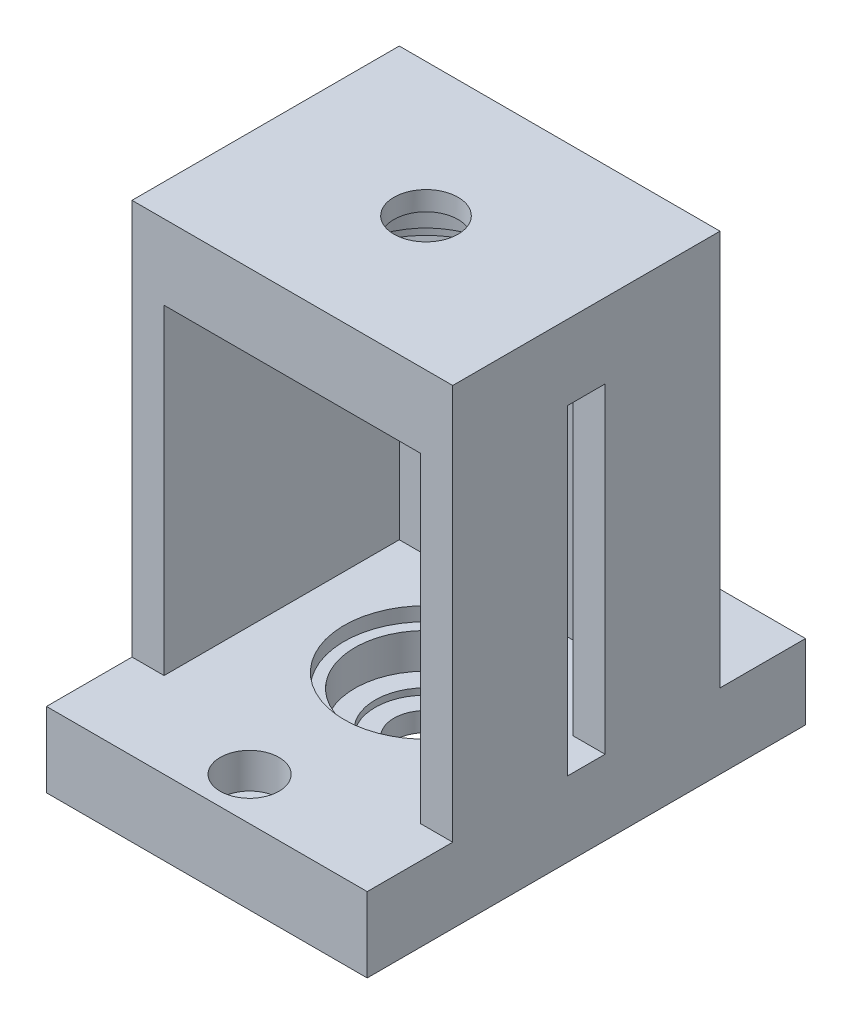
from build123d import *

# Parameters (mm, degrees)
SKETCH1_W               = 30
SKETCH1_H               = 25
BOSS_EXTRUDE1_DEPTH     = 7
BOSS_EXTRUDE2_DEPTH     = 30
SKETCH3_W               = 30
SKETCH3_H               = 25
BOSS_EXTRUDE3_DEPTH     = 7
SKETCH4_R               = 7.65
CUT_EXTRUDE1_DEPTH      = 1.3
CUT_EXTRUDE2_START      = -1.3
SKETCH5_R               = 7.65
CUT_EXTRUDE2_DEPTH      = 1.3
SKETCH6_R               = 6.65
CUT_EXTRUDE3_DEPTH      = 3.3
CUT_EXTRUDE4_START      = -3.3
SKETCH7_R               = 6.65
CUT_EXTRUDE4_DEPTH      = 3.3
SKETCH8_R               = 4.75
CUT_EXTRUDE5_DEPTH      = 0.6
CUT_EXTRUDE6_START      = -0.6
SKETCH9_R               = 4.75
CUT_EXTRUDE6_DEPTH      = 0.6
CUT_EXTRUDE7_DEPTH      = 47.498279538
CUT_EXTRUDE7_DEPTH_BACK = 47.498279538
SKETCH10_R              = 3
CUT_EXTRUDE8_DEPTH      = 55.701462503
CUT_EXTRUDE8_DEPTH_BACK = 10.6
SKETCH11_W              = 3.5
SKETCH11_H              = 30
SKETCH12_W              = 30
SKETCH12_H              = 8
SKETCH12_R              = 1.65
BOSS_EXTRUDE4_DEPTH     = 7
SKETCH13_R              = 2.75
CUT_EXTRUDE9_DEPTH      = 3.3


with BuildPart() as part:
    # Sketch1 → Boss-Extrude1 (new body)
    with BuildSketch(Plane(origin=(0, 0, 0), x_dir=(1, 0, 0), z_dir=(0, 1, 0))):
        Rectangle(SKETCH1_W, SKETCH1_H)
    extrude(amount=BOSS_EXTRUDE1_DEPTH)

    # Sketch2 → Boss-Extrude2 (add)
    with BuildSketch(Plane(origin=(0, 7, 0), x_dir=(1, 0, 0), z_dir=(0, 1, 0))):
        Polygon((-15, -12.5), (-12, -12.5), (-12, 9.5), (12, 9.5), (12, -12.5), (15, -12.5), (15, 12.5), (-15, 12.5), align=None)
    extrude(amount=BOSS_EXTRUDE2_DEPTH)

    # Sketch3 → Boss-Extrude3 (add)
    with BuildSketch(Plane(origin=(0, 37, 0), x_dir=(1, 0, 0), z_dir=(0, 1, 0))):
        Rectangle(SKETCH3_W, SKETCH3_H)
    extrude(amount=BOSS_EXTRUDE3_DEPTH)

    # Sketch4 → Cut-Extrude1 (cut)
    with BuildSketch(Plane(origin=(0, 7, 0), x_dir=(1, 0, 0), z_dir=(0, 1, 0))):
        with Locations(Location((0, 0, 0), (0, 0, 270))):
            Circle(SKETCH4_R)
    extrude(amount=-CUT_EXTRUDE1_DEPTH, mode=Mode.SUBTRACT)

    # Sketch5 → Cut-Extrude2 (cut)
    with BuildSketch(Plane.XZ.offset(-37).offset(CUT_EXTRUDE2_START)):
        with Locations(Location((0, 0, 0), (0, 0, 90))):
            Circle(SKETCH5_R)
    extrude(amount=CUT_EXTRUDE2_DEPTH, mode=Mode.SUBTRACT)

    # Sketch6 → Cut-Extrude3 (cut)
    with BuildSketch(Plane(origin=(0, 5.7, 0), x_dir=(1, 0, 0), z_dir=(0, 1, 0))):
        with Locations(Location((0, 0, 0), (0, 0, 270))):
            Circle(SKETCH6_R)
    extrude(amount=-CUT_EXTRUDE3_DEPTH, mode=Mode.SUBTRACT)

    # Sketch7 → Cut-Extrude4 (cut)
    with BuildSketch(Plane.XZ.offset(-38.3).offset(CUT_EXTRUDE4_START)):
        with Locations(Location((0, 0, 0), (0, 0, 90))):
            Circle(SKETCH7_R)
    extrude(amount=CUT_EXTRUDE4_DEPTH, mode=Mode.SUBTRACT)

    # Sketch8 → Cut-Extrude5 (cut)
    with BuildSketch(Plane(origin=(0, 2.4, 0), x_dir=(1, 0, 0), z_dir=(0, 1, 0))):
        with Locations(Location((0, 0, 0), (0, 0, 270))):
            Circle(SKETCH8_R)
    extrude(amount=-CUT_EXTRUDE5_DEPTH, mode=Mode.SUBTRACT)

    # Sketch9 → Cut-Extrude6 (cut)
    with BuildSketch(Plane.XZ.offset(-41.6).offset(CUT_EXTRUDE6_START)):
        with Locations(Location((0, 0, 0), (0, 0, 90))):
            Circle(SKETCH9_R)
    extrude(amount=CUT_EXTRUDE6_DEPTH, mode=Mode.SUBTRACT)

    # Sketch10 → Cut-Extrude7 (cut, two sides: drawn at the far end of the back side and taken through both)
    with BuildSketch(Plane(origin=(0, 1.8, 0), x_dir=(1, 0, 0), z_dir=(0, 1, 0)).offset(-CUT_EXTRUDE7_DEPTH_BACK)):
        with Locations(Location((0, 0, 0), (0, 0, 270))):
            Circle(SKETCH10_R)
    extrude(amount=CUT_EXTRUDE7_DEPTH + CUT_EXTRUDE7_DEPTH_BACK, mode=Mode.SUBTRACT)

    # Sketch11 → Cut-Extrude8 (cut, two sides: drawn at the far end of the back side and taken through both)
    with BuildSketch(Plane(origin=(15, 0, 0), x_dir=(0, 0, -1), z_dir=(1, 0, 0)).offset(-CUT_EXTRUDE8_DEPTH_BACK)):
        with Locations((0, 22)):
            Rectangle(SKETCH11_W, SKETCH11_H)
    extrude(amount=CUT_EXTRUDE8_DEPTH + CUT_EXTRUDE8_DEPTH_BACK, mode=Mode.SUBTRACT)

    # Sketch12 → Boss-Extrude4 (add)
    # profile 1 of 2: a face of its own
    with BuildSketch(Plane(origin=(0, 0, 0), x_dir=(1, 0, 0), z_dir=(0, 1, 0))):
        with Locations((0, -16.5)):
            Rectangle(SKETCH12_W, SKETCH12_H)
        with Locations(Location((0, -16.5, 0), (0, 0, 270))):
            Circle(SKETCH12_R, mode=Mode.SUBTRACT)
    # profile 2 of 2: a face of its own
    with BuildSketch(Plane(origin=(0, 0, 0), x_dir=(1, 0, 0), z_dir=(0, 1, 0))):
        with Locations((0, 16.5)):
            Rectangle(SKETCH12_W, SKETCH12_H)
        with Locations(Location((0, 16.5, 0), (0, 0, 90))):
            Circle(SKETCH12_R, mode=Mode.SUBTRACT)
    extrude(amount=BOSS_EXTRUDE4_DEPTH)

    # Sketch13 → Cut-Extrude9 (cut)
    with BuildSketch(Plane(origin=(0, 7, 0), x_dir=(1, 0, 0), z_dir=(0, 1, 0))):
        with Locations(Location((0, 16.5, 0), (0, 0, 270))):
            Circle(SKETCH13_R)
        with Locations(Location((0, -16.5, 0), (0, 0, 270))):
            Circle(SKETCH13_R)
    extrude(amount=-CUT_EXTRUDE9_DEPTH, mode=Mode.SUBTRACT)


solid = part.part
